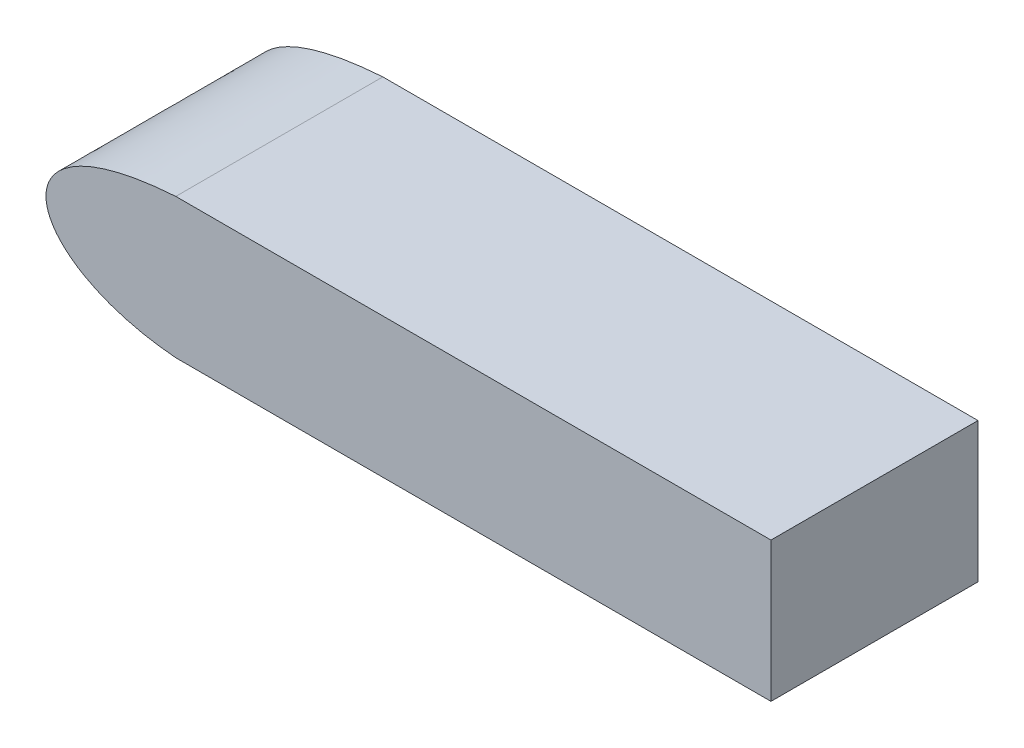
from build123d import *

# Parameters (mm, degrees)
BOSS_EXTRUDE1_DEPTH = 40


with BuildPart() as part:
    # Sketch1 → Boss-Extrude1 (new body)
    with BuildSketch(Plane.XY):
        with BuildLine():
            Line((0, 0), (115, 0))
            Line((115, 0), (115, 27))
            Line((115, 27), (0, 27))
            add(Edge.make_bspline(
                [(0, 0), (-29.600898329, 2.450638276), (-37.065768337, 24.549361724), (0, 27)],
                knots=[0, 0, 0, 0, 1, 1, 1, 1], degree=3))
        make_face()
    extrude(amount=-BOSS_EXTRUDE1_DEPTH)


solid = part.part
